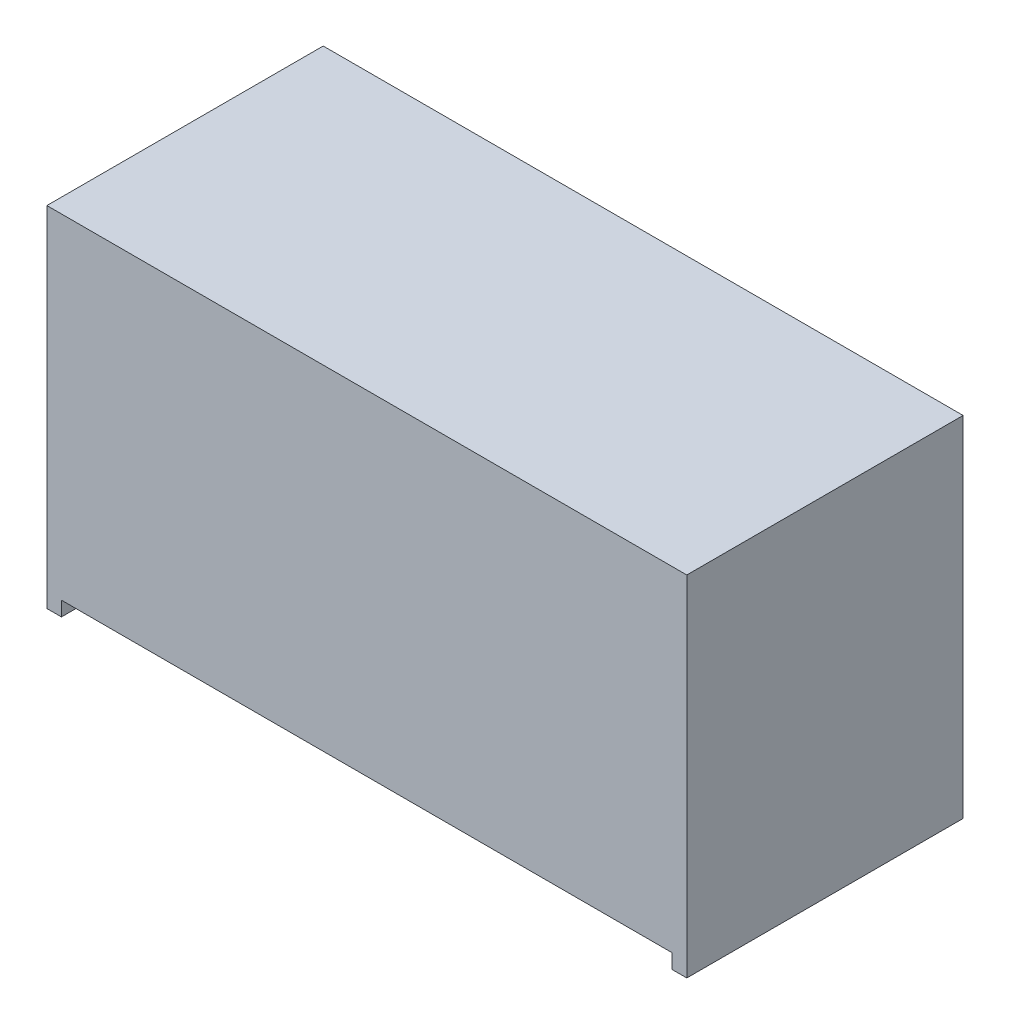
from build123d import *

# Parameters (mm, degrees)
SKETCH1_W           = 22
SKETCH1_H           = 9.5
BOSS_EXTRUDE1_DEPTH = 12
CUT_EXTRUDE1_REACH  = 20.848
SKETCH2_W           = 21
SKETCH2_H           = 1.851123708


with BuildPart() as part:
    # Sketch1 → Boss-Extrude1 (new body)
    with BuildSketch(Plane(origin=(0, 0, 0), x_dir=(1, 0, 0), z_dir=(0, 1, 0))):
        Rectangle(SKETCH1_W, SKETCH1_H)
    extrude(amount=BOSS_EXTRUDE1_DEPTH)

    # Sketch2 → Cut-Extrude1 (cut, up to next)
    with BuildSketch(Plane.XY.offset(4.75), mode=Mode.PRIVATE) as cut_extrude1_sk1:
        with Locations((0, -0.425561854)):
            Rectangle(SKETCH2_W, SKETCH2_H)
    cut_extrude1_tool1 = extrude(cut_extrude1_sk1.sketch, amount=-CUT_EXTRUDE1_REACH, mode=Mode.PRIVATE) & part.part
    add(cut_extrude1_tool1.solids().sort_by_distance((0, -0.425562, 4.75))[0], mode=Mode.SUBTRACT)


solid = part.part
